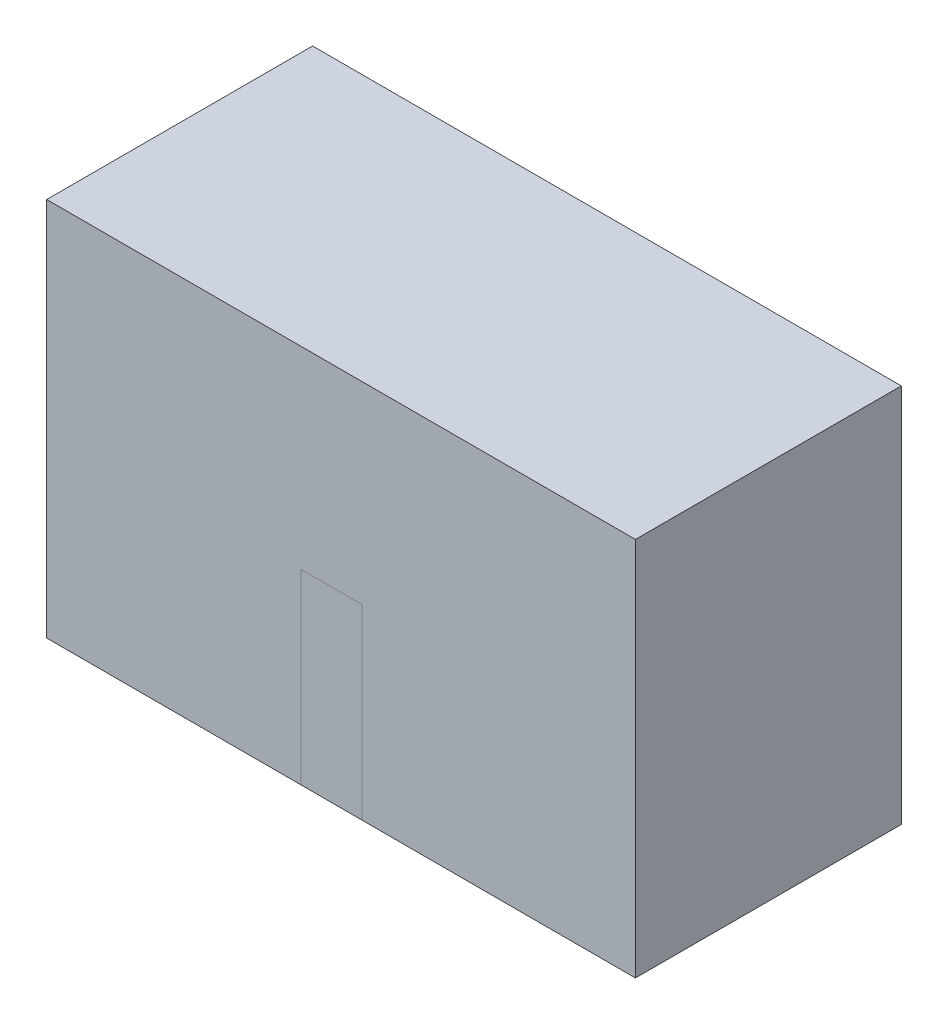
from build123d import *

# Parameters (mm, degrees)
FLUID_BOX_START    = -150
SKETCH1_W          = 140
SKETCH1_H          = 200
FLUID_BOX_DEPTH    = 310
ROTOR_TOOL_DEPTH   = 16
DUCT_TOOL_START    = 18
SKETCH3_W          = 64
SKETCH3_H          = 104
SKETCH3_W_2        = 61.115879828
SKETCH3_H_2        = 99.313304722
DUCT_TOOL_DEPTH    = 80
LOUVER1_TOOL_START = 49
SKETCH4_W          = 56
SKETCH4_H          = 2
LOUVER1_TOOL_DEPTH = 18
LOUVER2_TOOL_START = 49
SKETCH5_W          = 56
SKETCH5_H          = 2
LOUVER2_TOOL_DEPTH = 18
LOUVER3_TOOL_START = 49
SKETCH6_W          = 56
SKETCH6_H          = 2
LOUVER3_TOOL_DEPTH = 18
LOUVER4_TOOL_START = 49
SKETCH7_W          = 56
SKETCH7_H          = 2
LOUVER4_TOOL_DEPTH = 18
POCKET_TOOL_START  = -33
SKETCH8_W          = 13
SKETCH8_H          = 29
POCKET_TOOL_DEPTH  = 17
ROTOR_KEEP_DEPTH   = 16
DUCT_KEEP_START    = 18
SKETCH10_W         = 64
SKETCH10_H         = 104
SKETCH10_W_2       = 61.115879828
SKETCH10_H_2       = 99.313304722
DUCT_KEEP_DEPTH    = 80
LOUVER1_KEEP_START = 49
SKETCH11_W         = 56
SKETCH11_H         = 2
LOUVER1_KEEP_DEPTH = 18
LOUVER2_KEEP_START = 49
SKETCH12_W         = 56
SKETCH12_H         = 2
LOUVER2_KEEP_DEPTH = 18
LOUVER3_KEEP_START = 49
SKETCH13_W         = 56
SKETCH13_H         = 2
LOUVER3_KEEP_DEPTH = 18
LOUVER4_KEEP_START = 49
SKETCH14_W         = 56
SKETCH14_H         = 2
LOUVER4_KEEP_DEPTH = 18
POCKET_KEEP_START  = -33
SKETCH15_W         = 13
SKETCH15_H         = 29
POCKET_KEEP_DEPTH  = 17


with BuildPart() as part:
    # Sketch1 → fluid_box (new body)
    with BuildSketch(Plane(origin=(0, 0, 0), x_dir=(0, 0, -1), z_dir=(1, 0, 0)).offset(FLUID_BOX_START)):
        with Locations((0, 150)):
            Rectangle(SKETCH1_W, SKETCH1_H)
    extrude(amount=FLUID_BOX_DEPTH)


with BuildPart() as body_2:
    # Sketch2 → rotor_tool (new, symmetric)
    with BuildSketch(Plane(origin=(0, 0, 0), x_dir=(0, 0, -1), z_dir=(1, 0, 0))):
        with BuildLine():
            Line((70, 50), (-70, 50))
            Line((-70, 50), (-70, 148.310485132))
            ThreePointArc((-70, 148.310485132), (0, 164), (70, 148.310485132))
            Line((70, 148.310485132), (70, 50))
        make_face()
    extrude(amount=ROTOR_TOOL_DEPTH, both=True)


with BuildPart() as body_3:
    # Sketch3 → duct_tool (new body)
    with BuildSketch(Plane(origin=(0, 0, 0), x_dir=(0, 0, -1), z_dir=(1, 0, 0)).offset(DUCT_TOOL_START)):
        with Locations((0, 140)):
            Rectangle(SKETCH3_W, SKETCH3_H)
        with Locations((0, 140)):
            Rectangle(SKETCH3_W_2, SKETCH3_H_2, mode=Mode.SUBTRACT)
    extrude(amount=DUCT_TOOL_DEPTH)


with BuildPart() as body_4:
    # Sketch4 → louver1_tool (new body)
    with BuildSketch(Plane(origin=(0, 0, 0), x_dir=(0, 0, -1), z_dir=(1, 0, 0)).offset(LOUVER1_TOOL_START)):
        with Locations((0, 110)):
            Rectangle(SKETCH4_W, SKETCH4_H)
    extrude(amount=LOUVER1_TOOL_DEPTH)


with BuildPart() as body_5:
    # Sketch5 → louver2_tool (new body)
    with BuildSketch(Plane(origin=(0, 0, 0), x_dir=(0, 0, -1), z_dir=(1, 0, 0)).offset(LOUVER2_TOOL_START)):
        with Locations((0, 130)):
            Rectangle(SKETCH5_W, SKETCH5_H)
    extrude(amount=LOUVER2_TOOL_DEPTH)


with BuildPart() as body_6:
    # Sketch6 → louver3_tool (new body)
    with BuildSketch(Plane(origin=(0, 0, 0), x_dir=(0, 0, -1), z_dir=(1, 0, 0)).offset(LOUVER3_TOOL_START)):
        with Locations((0, 150)):
            Rectangle(SKETCH6_W, SKETCH6_H)
    extrude(amount=LOUVER3_TOOL_DEPTH)


with BuildPart() as body_7:
    # Sketch7 → louver4_tool (new body)
    with BuildSketch(Plane(origin=(0, 0, 0), x_dir=(0, 0, -1), z_dir=(1, 0, 0)).offset(LOUVER4_TOOL_START)):
        with Locations((0, 170)):
            Rectangle(SKETCH7_W, SKETCH7_H)
    extrude(amount=LOUVER4_TOOL_DEPTH)


with BuildPart() as body_8:
    # Sketch8 → pocket_tool (new body)
    with BuildSketch(Plane(origin=(0, 0, 0), x_dir=(0, 0, -1), z_dir=(1, 0, 0)).offset(POCKET_TOOL_START)):
        with Locations((0, 114.5)):
            Rectangle(SKETCH8_W, SKETCH8_H)
    extrude(amount=POCKET_TOOL_DEPTH)


with BuildPart() as part_1:
    add(part.part)

    # Combine1: cut body 5, body 3, body 7, body 6, body 8, body 2, body 4
    add(body_5.part, mode=Mode.SUBTRACT)
    add(body_3.part, mode=Mode.SUBTRACT)
    add(body_7.part, mode=Mode.SUBTRACT)
    add(body_6.part, mode=Mode.SUBTRACT)
    add(body_8.part, mode=Mode.SUBTRACT)
    add(body_2.part, mode=Mode.SUBTRACT)
    add(body_4.part, mode=Mode.SUBTRACT)


with BuildPart() as body_2_2:
    # Sketch9 → rotor_keep (new, symmetric)
    with BuildSketch(Plane(origin=(0, 0, 0), x_dir=(0, 0, -1), z_dir=(1, 0, 0))):
        with BuildLine():
            Line((70, 50), (-70, 50))
            Line((-70, 50), (-70, 148.310485132))
            ThreePointArc((-70, 148.310485132), (0, 164), (70, 148.310485132))
            Line((70, 148.310485132), (70, 50))
        make_face()
    extrude(amount=ROTOR_KEEP_DEPTH, both=True)


with BuildPart() as body_3_2:
    # Sketch10 → duct_keep (new body)
    with BuildSketch(Plane(origin=(0, 0, 0), x_dir=(0, 0, -1), z_dir=(1, 0, 0)).offset(DUCT_KEEP_START)):
        with Locations((0, 140)):
            Rectangle(SKETCH10_W, SKETCH10_H)
        with Locations((0, 140)):
            Rectangle(SKETCH10_W_2, SKETCH10_H_2, mode=Mode.SUBTRACT)
    extrude(amount=DUCT_KEEP_DEPTH)


with BuildPart() as body_4_2:
    # Sketch11 → louver1_keep (new body)
    with BuildSketch(Plane(origin=(0, 0, 0), x_dir=(0, 0, -1), z_dir=(1, 0, 0)).offset(LOUVER1_KEEP_START)):
        with Locations((0, 110)):
            Rectangle(SKETCH11_W, SKETCH11_H)
    extrude(amount=LOUVER1_KEEP_DEPTH)


with BuildPart() as body_5_2:
    # Sketch12 → louver2_keep (new body)
    with BuildSketch(Plane(origin=(0, 0, 0), x_dir=(0, 0, -1), z_dir=(1, 0, 0)).offset(LOUVER2_KEEP_START)):
        with Locations((0, 130)):
            Rectangle(SKETCH12_W, SKETCH12_H)
    extrude(amount=LOUVER2_KEEP_DEPTH)


with BuildPart() as body_6_2:
    # Sketch13 → louver3_keep (new body)
    with BuildSketch(Plane(origin=(0, 0, 0), x_dir=(0, 0, -1), z_dir=(1, 0, 0)).offset(LOUVER3_KEEP_START)):
        with Locations((0, 150)):
            Rectangle(SKETCH13_W, SKETCH13_H)
    extrude(amount=LOUVER3_KEEP_DEPTH)


with BuildPart() as body_7_2:
    # Sketch14 → louver4_keep (new body)
    with BuildSketch(Plane(origin=(0, 0, 0), x_dir=(0, 0, -1), z_dir=(1, 0, 0)).offset(LOUVER4_KEEP_START)):
        with Locations((0, 170)):
            Rectangle(SKETCH14_W, SKETCH14_H)
    extrude(amount=LOUVER4_KEEP_DEPTH)


with BuildPart() as body_8_2:
    # Sketch15 → pocket_keep (new body)
    with BuildSketch(Plane(origin=(0, 0, 0), x_dir=(0, 0, -1), z_dir=(1, 0, 0)).offset(POCKET_KEEP_START)):
        with Locations((0, 114.5)):
            Rectangle(SKETCH15_W, SKETCH15_H)
    extrude(amount=POCKET_KEEP_DEPTH)


solid = Compound([part_1.part, body_2_2.part, body_3_2.part, body_4_2.part, body_5_2.part, body_6_2.part, body_7_2.part, body_8_2.part])
